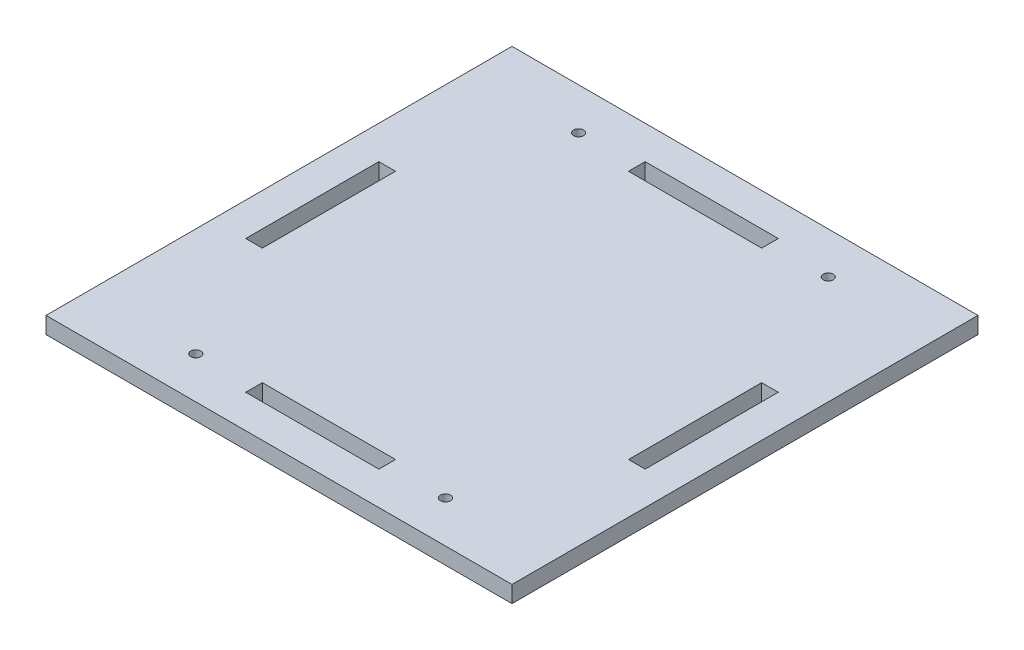
from build123d import *

# Parameters (mm, degrees)
CROQUIS2_W              = 140
CROQUIS2_H              = 140
CROQUIS2_R              = 1.5
CROQUIS2_W_2            = 40
CROQUIS2_H_2            = 5
CROQUIS2_W_3            = 5
CROQUIS2_H_3            = 40
SALIENTE_EXTRUIR1_DEPTH = 5


with BuildPart() as part:
    # Croquis2 → Saliente-Extruir1 (new body)
    with BuildSketch(Plane(origin=(0, 0, 0), x_dir=(1, 0, 0), z_dir=(0, 1, 0))):
        with Locations((70, 70)):
            Rectangle(CROQUIS2_W, CROQUIS2_H)
        with Locations(Location((32.5, 127.5, 0), (0, 0, 270))):
            Circle(CROQUIS2_R, mode=Mode.SUBTRACT)
        with Locations(Location((107.5, 127.5, 0), (0, 0, 90))):
            Circle(CROQUIS2_R, mode=Mode.SUBTRACT)
        with Locations(Location((107.5, 12.5, 0), (0, 0, 270))):
            Circle(CROQUIS2_R, mode=Mode.SUBTRACT)
        with Locations(Location((32.5, 12.5, 0), (0, 0, 90))):
            Circle(CROQUIS2_R, mode=Mode.SUBTRACT)
        with Locations((70, 127.5)):
            Rectangle(CROQUIS2_W_2, CROQUIS2_H_2, mode=Mode.SUBTRACT)
        with Locations((70, 12.5)):
            Rectangle(CROQUIS2_W_2, CROQUIS2_H_2, mode=Mode.SUBTRACT)
        with Locations((127.5, 70)):
            Rectangle(CROQUIS2_W_3, CROQUIS2_H_3, mode=Mode.SUBTRACT)
        with Locations((12.5, 70)):
            Rectangle(CROQUIS2_W_3, CROQUIS2_H_3, mode=Mode.SUBTRACT)
    extrude(amount=SALIENTE_EXTRUIR1_DEPTH)


solid = part.part
